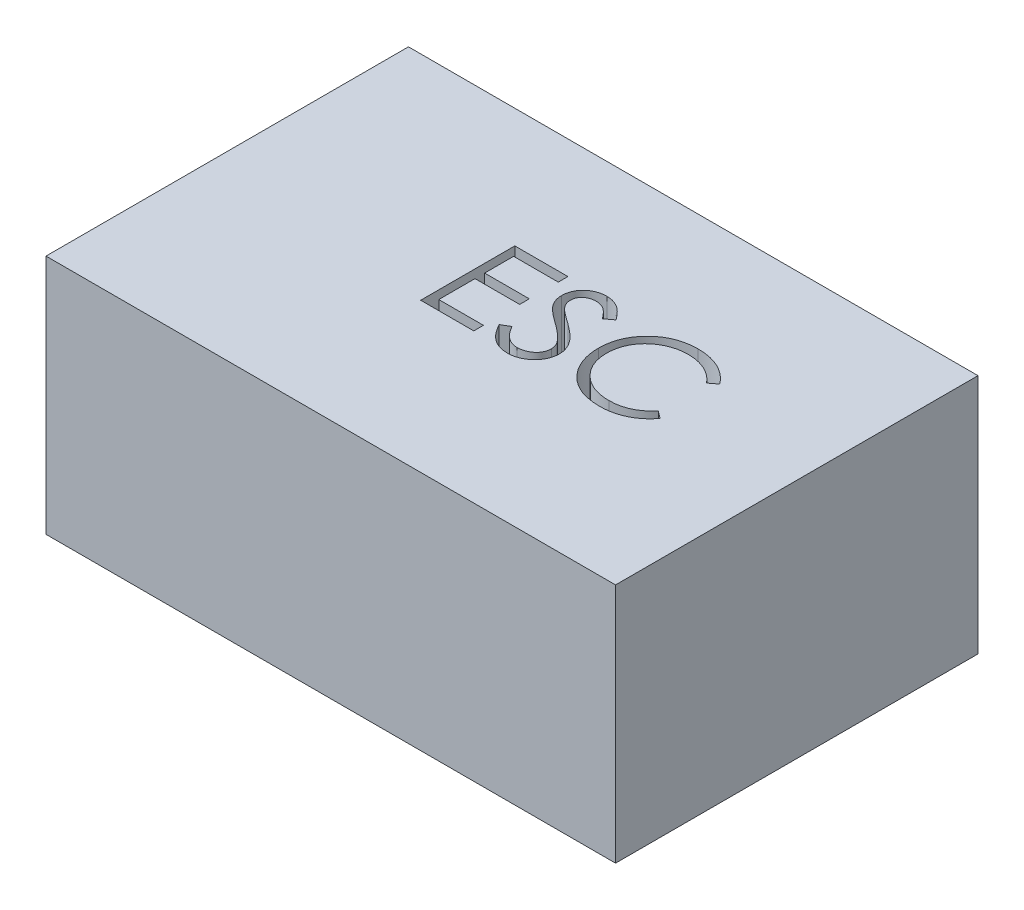
from build123d import *

# Parameters (mm, degrees)
SKETCH1_W           = 60.5
SKETCH1_H           = 38.5
BOSS_EXTRUDE1_DEPTH = 25.6
CUT_EXTRUDE1_DEPTH  = 10


with BuildPart() as part:
    # Sketch1 → Boss-Extrude1 (new body)
    with BuildSketch(Plane(origin=(0, 0, 0), x_dir=(1, 0, 0), z_dir=(0, 1, 0))):
        with Locations((30.25, 19.25)):
            Rectangle(SKETCH1_W, SKETCH1_H)
    extrude(amount=BOSS_EXTRUDE1_DEPTH)

    # Sketch2 → Cut-Extrude1 (cut)
    with BuildSketch(Plane(origin=(0, 25.6, 0), x_dir=(1, 0, 0), z_dir=(0, 1, 0))):
        Polygon((23.963191453, 25.836787702), (29.604217094, 25.836787702), (29.604217094, 24.811146676), (24.86062735, 24.811146676), (24.86062735, 21.734223599), (29.604217094, 21.734223599), (29.604217094, 20.708582573), (24.86062735, 20.708582573), (24.86062735, 16.862428727), (29.604217094, 16.862428727), (29.604217094, 15.836787702), (23.963191453, 15.836787702), align=None)
        with BuildLine():
            Line((30.373447863, 17.76587424), (31.218800427, 18.272685138))
            add(Edge.make_bspline(
                [(31.218800427, 18.272685138), (31.297423962, 18.141072609), (31.448063621, 17.888908084), (31.699353219, 17.548170825), (31.959732965, 17.258564663), (32.231131061, 17.021774356), (32.511890913, 16.835348965), (32.803845352, 16.703342589), (33.106010525, 16.621011231), (33.311650015, 16.611010983), (33.414313248, 16.606018471)],
                knots=[0, 0, 0, 0, 1.272034388, 2.437168799, 3.508375237, 4.49857839, 5.41946034, 6.295179144, 7.148887113, 8, 8, 8, 8], degree=3))
            add(Edge.make_bspline(
                [(33.414313248, 16.606018471), (33.501989992, 16.608460392), (33.675809344, 16.613301507), (33.931701467, 16.659818085), (34.180220902, 16.73128131), (34.416245581, 16.833626829), (34.636518765, 16.957451074), (34.829680752, 17.107011581), (34.996669647, 17.274457883), (35.133267117, 17.461265468), (35.238067218, 17.662171606), (35.318615985, 17.86838861), (35.363316195, 18.083155948), (35.370049776, 18.227757271), (35.373447863, 18.300730009)],
                knots=[0, 0, 0, 0, 1.095163259, 2.171163733, 3.241058638, 4.321873601, 5.38011039, 6.391990106, 7.366004449, 8.327778327, 9.272591725, 10.192022065, 11.087607919, 12, 12, 12, 12], degree=3))
            add(Edge.make_bspline(
                [(35.373447863, 18.300730009), (35.369235547, 18.38398958), (35.360672524, 18.55324412), (35.288296866, 18.802957415), (35.174441875, 19.050079043), (35.06940575, 19.202939802), (35.014874145, 19.282300522)],
                knots=[0, 0, 0, 0, 0.938893495, 1.908633276, 2.914225137, 4, 4, 4, 4], degree=3))
            add(Edge.make_bspline(
                [(35.014874145, 19.282300522), (34.970100962, 19.339577161), (34.876105264, 19.4598223), (34.714512371, 19.638808687), (34.524894901, 19.823432741), (34.313741887, 20.020744332), (34.073361634, 20.221566609), (33.811283021, 20.435475974), (33.520814853, 20.654337623), (33.317102005, 20.801116382), (33.21198953, 20.876851804)],
                knots=[0, 0, 0, 0, 0.722233717, 1.516239348, 2.393582979, 3.351407094, 4.387010283, 5.505090956, 6.712668013, 8, 8, 8, 8], degree=3))
            add(Edge.make_bspline(
                [(33.21198953, 20.876851804), (33.106778112, 20.951790626), (32.905621894, 21.095067947), (32.624311658, 21.307708758), (32.37275605, 21.502119814), (32.152073145, 21.680131277), (31.962360011, 21.841767291), (31.802121694, 21.985475688), (31.675440103, 22.115143005), (31.604995586, 22.199261124), (31.573367735, 22.237028086)],
                knots=[0, 0, 0, 0, 1.452282411, 2.77665338, 3.964542531, 5.026858415, 5.96415736, 6.766646006, 7.446254459, 8, 8, 8, 8], degree=3))
            add(Edge.make_bspline(
                [(31.573367735, 22.237028086), (31.529160463, 22.295888192), (31.44222093, 22.411644488), (31.327460914, 22.592572653), (31.229920449, 22.777781983), (31.153456643, 22.967770167), (31.089067446, 23.159869964), (31.045759073, 23.356587809), (31.018640796, 23.557041005), (31.015863691, 23.691936721), (31.014473504, 23.759463984)],
                knots=[0, 0, 0, 0, 1.068054152, 2.10047183, 3.106115577, 4.101338837, 5.06977816, 6.043150881, 7.020423561, 8, 8, 8, 8], degree=3))
            add(Edge.make_bspline(
                [(31.014473504, 23.759463984), (31.018202673, 23.86526334), (31.025581302, 24.074600665), (31.08798278, 24.380403037), (31.186476761, 24.672364229), (31.324462155, 24.947593754), (31.502340307, 25.198925128), (31.708185948, 25.429249377), (31.953361623, 25.622873897), (32.222369118, 25.792051207), (32.516815895, 25.924468136), (32.825361333, 26.024356651), (33.148495825, 26.08095453), (33.367361924, 26.089076716), (33.478415812, 26.093197958)],
                knots=[0, 0, 0, 0, 1.005424448, 1.989358655, 2.955360095, 3.929531133, 4.905563448, 5.876582895, 6.856512386, 7.866279853, 8.892233794, 9.918561126, 10.94386622, 12, 12, 12, 12], degree=3))
            add(Edge.make_bspline(
                [(33.478415812, 26.093197958), (33.596256099, 26.089133525), (33.830602818, 26.081050665), (34.175314862, 26.010772004), (34.507202624, 25.89448437), (34.77418338, 25.762516776), (34.983134127, 25.630712731), (35.142484792, 25.51065609), (35.303963223, 25.372441494), (35.468871951, 25.215700791), (35.634416692, 25.038995788), (35.803055127, 24.843536677), (35.975181609, 24.630517946), (36.085912638, 24.478447944), (36.142678633, 24.400489625)],
                knots=[0, 0, 0, 0, 1.286793592, 2.559021753, 3.825965368, 5.121522368, 5.803751409, 6.523245864, 7.299691795, 8.125521123, 9.008227632, 9.944561021, 10.946284179, 12, 12, 12, 12], degree=3))
            Line((36.142678633, 24.400489625), (35.331380556, 23.78550565))
            add(Edge.make_bspline(
                [(35.331380556, 23.78550565), (35.282392177, 23.848616194), (35.188052014, 23.970152347), (35.044824909, 24.140356105), (34.909828772, 24.295831761), (34.77682763, 24.430874984), (34.652845825, 24.552881079), (34.532511419, 24.657337527), (34.41755613, 24.7452678), (34.272650671, 24.839106543), (34.090600047, 24.932125124), (33.862072801, 25.010836776), (33.623254872, 25.058136953), (33.460598782, 25.064390917), (33.378255556, 25.067556932)],
                knots=[0, 0, 0, 0, 1.181633172, 2.275549214, 3.290209073, 4.226197932, 5.078386478, 5.862611352, 6.581680152, 7.217281963, 8.414376989, 9.595101626, 10.782541182, 12, 12, 12, 12], degree=3))
            add(Edge.make_bspline(
                [(33.378255556, 25.067556932), (33.274951206, 25.064094933), (33.075738499, 25.057418792), (32.792909253, 24.984504548), (32.538355181, 24.869699233), (32.319633567, 24.708799296), (32.137527918, 24.518167888), (32.005798036, 24.298799731), (31.926511852, 24.056564295), (31.916836767, 23.887588134), (31.911909402, 23.801531291)],
                knots=[0, 0, 0, 0, 1.14458467, 2.207223713, 3.21896685, 4.227309161, 5.202851033, 6.127160689, 7.046193047, 8, 8, 8, 8], degree=3))
            add(Edge.make_bspline(
                [(31.911909402, 23.801531291), (31.913032621, 23.747955638), (31.915280895, 23.640716726), (31.94663746, 23.482284092), (31.986921257, 23.324251693), (32.050757348, 23.167330028), (32.138886787, 23.008774716), (32.254615861, 22.845855466), (32.400368181, 22.677136299), (32.512016788, 22.567400945), (32.570963889, 22.509463984)],
                knots=[0, 0, 0, 0, 0.858281714, 1.717966888, 2.583508476, 3.4729293, 4.427298488, 5.488583878, 6.674047936, 8, 8, 8, 8], degree=3))
            add(Edge.make_bspline(
                [(32.570963889, 22.509463984), (32.592853524, 22.489929624), (32.644858288, 22.443520458), (32.739932361, 22.367542513), (32.865483213, 22.273820306), (33.018232359, 22.157856545), (33.20099625, 22.023338082), (33.413794982, 21.871984904), (33.654256504, 21.698883593), (33.82489055, 21.577862048), (33.91511453, 21.513871035)],
                knots=[0, 0, 0, 0, 0.420754252, 0.999615792, 1.744751191, 2.668019286, 3.750313428, 4.999500688, 6.413464383, 8, 8, 8, 8], degree=3))
            add(Edge.make_bspline(
                [(33.91511453, 21.513871035), (34.023645711, 21.434895722), (34.233801301, 21.281970974), (34.532822957, 21.052211888), (34.803948123, 20.827503978), (35.048128705, 20.609282244), (35.267777015, 20.399201978), (35.460456217, 20.194735748), (35.628129589, 19.997348398), (35.808641642, 19.744283896), (35.993092555, 19.433480798), (36.151496862, 19.052685831), (36.251377855, 18.670410629), (36.264439327, 18.413476811), (36.270883761, 18.286707573)],
                knots=[0, 0, 0, 0, 1.163667725, 2.253281268, 3.268753668, 4.215851969, 5.092017293, 5.902905408, 6.650798638, 7.335211899, 8.59617414, 9.77448103, 10.901945474, 12, 12, 12, 12], degree=3))
            add(Edge.make_bspline(
                [(36.270883761, 18.286707573), (36.269006223, 18.197055102), (36.265287609, 18.019491149), (36.222542141, 17.758762358), (36.159914526, 17.505531301), (36.065522429, 17.262928123), (35.950313405, 17.026514515), (35.804124126, 16.802491943), (35.634673598, 16.585902233), (35.440291413, 16.382520829), (35.227588835, 16.195817412), (35.002778278, 16.029734379), (34.765491784, 15.891253455), (34.517016594, 15.778251049), (34.257295632, 15.68986957), (33.986416249, 15.625832801), (33.703931932, 15.58653077), (33.511930556, 15.582451452), (33.414313248, 15.580377445)],
                knots=[0, 0, 0, 0, 0.983748083, 1.948392443, 2.894712957, 3.844097841, 4.80183111, 5.778335162, 6.776009319, 7.81870978, 8.863265674, 9.881300176, 10.883814829, 11.87499822, 12.874611388, 13.892143829, 14.928324115, 16, 16, 16, 16], degree=3))
            add(Edge.make_bspline(
                [(33.414313248, 15.580377445), (33.338783697, 15.581837964), (33.188675811, 15.584740608), (32.96664872, 15.610401409), (32.749107036, 15.64670742), (32.538780516, 15.704347619), (32.33295934, 15.77428184), (32.13253867, 15.860391361), (31.937421373, 15.963583365), (31.746513994, 16.08156915), (31.560302066, 16.218876992), (31.380532158, 16.378801267), (31.201305913, 16.556931281), (31.027913353, 16.75810432), (30.856847226, 16.979070271), (30.691480342, 17.221896509), (30.52838972, 17.485260377), (30.426059812, 17.670589193), (30.373447863, 17.76587424)],
                knots=[0, 0, 0, 0, 0.915332311, 1.819136955, 2.706846663, 3.586547465, 4.459518054, 5.340707479, 6.227863349, 7.133153174, 8.059268498, 9.028702269, 10.047606654, 11.120612155, 12.245963614, 13.433783089, 14.680604001, 16, 16, 16, 16], degree=3))
        make_face()
        with BuildLine():
            Line((47.552935043, 24.001851804), (46.767678633, 23.400890266))
            add(Edge.make_bspline(
                [(46.767678633, 23.400890266), (46.711661809, 23.46765018), (46.600383389, 23.600269939), (46.421357096, 23.786497209), (46.234780974, 23.960969384), (46.040726342, 24.124517612), (45.835700286, 24.271422657), (45.624669433, 24.409340094), (45.404103589, 24.532962202), (45.099098633, 24.682856448), (44.700104781, 24.839274034), (44.197833812, 24.970426123), (43.673516388, 25.053915197), (43.31580896, 25.062957601), (43.13386453, 25.067556932)],
                knots=[0, 0, 0, 0, 0.757959112, 1.505699292, 2.245454638, 2.979532153, 3.711538275, 4.438200793, 5.171680507, 5.909471876, 7.393775596, 8.890124382, 10.418191784, 12, 12, 12, 12], degree=3))
            add(Edge.make_bspline(
                [(43.13386453, 25.067556932), (43.033626532, 25.066402754), (42.834080839, 25.064105108), (42.537942343, 25.033793322), (42.247333626, 24.991189865), (41.962443722, 24.927974656), (41.683635269, 24.848052887), (41.409085549, 24.752551704), (41.14276955, 24.634395019), (40.881003155, 24.503799991), (40.630205409, 24.356293006), (40.392905272, 24.195397714), (40.169968221, 24.022914582), (39.961217901, 23.838197135), (39.766440906, 23.642077248), (39.587048589, 23.432464843), (39.423661703, 23.210030062), (39.273041631, 22.97770604), (39.138148107, 22.736169493), (39.025205594, 22.484526434), (38.92519096, 22.22708614), (38.846050266, 21.960939966), (38.78340879, 21.687960635), (38.740186895, 21.407415527), (38.710219834, 21.119890728), (38.707933614, 20.925006978), (38.706781197, 20.826771676)],
                knots=[0, 0, 0, 0, 1.054917814, 2.100044995, 3.131103042, 4.146048494, 5.169673617, 6.183595914, 7.203665975, 8.234915748, 9.262203917, 10.264457458, 11.251630812, 12.227803204, 13.197192746, 14.159520551, 15.12972552, 16.100847026, 17.073214652, 18.039054194, 19.002613845, 19.979014051, 20.95965708, 21.949030935, 22.966165397, 24, 24, 24, 24], degree=3))
            add(Edge.make_bspline(
                [(38.706781197, 20.826771676), (38.710386394, 20.678967905), (38.71746472, 20.388774805), (38.780459961, 19.963715918), (38.876188793, 19.556513993), (39.01966187, 19.169714443), (39.196573443, 18.798547706), (39.420118047, 18.449293839), (39.67902244, 18.116675083), (39.976949352, 17.808552376), (40.303823112, 17.527084589), (40.654531431, 17.279225785), (41.028200825, 17.072611835), (41.420705483, 16.900680559), (41.835065808, 16.76851848), (42.270536672, 16.675478127), (42.726170944, 16.614786183), (43.037512087, 16.608975645), (43.195963889, 16.606018471)],
                knots=[0, 0, 0, 0, 1.029171465, 2.020641659, 2.987623507, 3.938342917, 4.889210282, 5.84687017, 6.821220943, 7.821438502, 8.827599549, 9.822697543, 10.807740252, 11.797342354, 12.80366471, 13.83203677, 14.896651826, 16, 16, 16, 16], degree=3))
            add(Edge.make_bspline(
                [(43.195963889, 16.606018471), (43.370543, 16.610843556), (43.714156454, 16.620340477), (44.218065101, 16.700795475), (44.700453003, 16.831246669), (45.161346107, 17.013812161), (45.599445096, 17.251141555), (46.015435554, 17.538849776), (46.409668613, 17.879673584), (46.646729419, 18.139911093), (46.767678633, 18.272685138)],
                knots=[0, 0, 0, 0, 1.028121516, 2.023589091, 2.998037872, 3.967518031, 4.937445131, 5.927275754, 6.942489185, 8, 8, 8, 8], degree=3))
            Line((46.767678633, 18.272685138), (47.552935043, 17.677733214))
            add(Edge.make_bspline(
                [(47.552935043, 17.677733214), (47.489740443, 17.59619478), (47.363653942, 17.433508477), (47.15948818, 17.204160735), (46.944410187, 16.988434919), (46.716822444, 16.788070287), (46.47934304, 16.599057528), (46.227707861, 16.426766582), (45.965224911, 16.268792626), (45.692783543, 16.124144271), (45.410673221, 15.995809279), (45.119231978, 15.885941371), (44.819716048, 15.79129883), (44.512111738, 15.713436153), (44.195781005, 15.652661628), (43.871865364, 15.612033986), (43.539665721, 15.584199944), (43.315547375, 15.581663042), (43.201973504, 15.580377445)],
                knots=[0, 0, 0, 0, 0.986787822, 1.968848986, 2.935600012, 3.899624008, 4.868462664, 5.837806735, 6.815139263, 7.798259679, 8.787526145, 9.778297419, 10.776456485, 11.791383307, 12.812564526, 13.85620153, 14.913611965, 16, 16, 16, 16], degree=3))
            add(Edge.make_bspline(
                [(43.201973504, 15.580377445), (43.09442017, 15.581125995), (42.88174677, 15.582606161), (42.567750336, 15.606583782), (42.26206582, 15.639297316), (41.965566889, 15.688554833), (41.676635532, 15.746681519), (41.397891004, 15.824599395), (41.126590403, 15.911882728), (40.863823716, 16.014468405), (40.609367431, 16.130228926), (40.364042255, 16.261061952), (40.12796102, 16.405867279), (39.898802674, 16.561453023), (39.679952435, 16.732816743), (39.469513792, 16.917578556), (39.266306717, 17.115115729), (39.14058476, 17.257558167), (39.077374145, 17.329175522)],
                knots=[0, 0, 0, 0, 1.114604814, 2.203992996, 3.262667896, 4.300477797, 5.318619304, 6.316056647, 7.298880507, 8.271930387, 9.238335007, 10.195173496, 11.151986948, 12.108099108, 13.064862484, 14.031167946, 15.010108607, 16, 16, 16, 16], degree=3))
            add(Edge.make_bspline(
                [(39.077374145, 17.329175522), (38.97612945, 17.453578919), (38.774862373, 17.700883806), (38.51736042, 18.101700895), (38.296938834, 18.520181492), (38.118721917, 18.958524146), (37.979399822, 19.415745252), (37.882882122, 19.892075293), (37.820163252, 20.387069414), (37.812990999, 20.723745953), (37.809345299, 20.89488065)],
                knots=[0, 0, 0, 0, 0.994628077, 1.977248131, 2.950237994, 3.925870899, 4.908910175, 5.911660606, 6.938484602, 8, 8, 8, 8], degree=3))
            add(Edge.make_bspline(
                [(37.809345299, 20.89488065), (37.813788709, 21.074753375), (37.822530841, 21.428641731), (37.896804543, 21.947995883), (38.016286818, 22.445571308), (38.185992214, 22.92043915), (38.40115036, 23.375097093), (38.666940685, 23.806071964), (38.980275378, 24.216119963), (39.338696999, 24.599019253), (39.731746529, 24.949131689), (40.152657426, 25.257149414), (40.600605846, 25.513485174), (41.07065685, 25.727759924), (41.566330226, 25.89245839), (42.086568424, 26.007753209), (42.630393895, 26.079516398), (43.001429397, 26.088588421), (43.189954274, 26.093197958)],
                knots=[0, 0, 0, 0, 1.032925535, 2.032216505, 3.007276963, 3.968222605, 4.92396291, 5.891752235, 6.871517503, 7.883894988, 8.900124299, 9.891468569, 10.874487609, 11.85992873, 12.854644235, 13.869047385, 14.917252991, 16, 16, 16, 16], degree=3))
            add(Edge.make_bspline(
                [(43.189954274, 26.093197958), (43.304852765, 26.09182042), (43.532282757, 26.089093723), (43.868718907, 26.062504746), (44.196268412, 26.018180157), (44.515156933, 25.957848529), (44.826935836, 25.882970467), (45.129222238, 25.785426758), (45.423789915, 25.673893811), (45.708781081, 25.545441051), (45.982828368, 25.401250362), (46.24584642, 25.242920009), (46.495746017, 25.070646279), (46.734285584, 24.885894349), (46.957474758, 24.684755608), (47.171650411, 24.472762477), (47.369539206, 24.243808693), (47.491691192, 24.082651739), (47.552935043, 24.001851804)],
                knots=[0, 0, 0, 0, 1.096760587, 2.17092713, 3.219439832, 4.250915756, 5.268269357, 6.278326846, 7.281116186, 8.274029601, 9.260640565, 10.235837813, 11.203064059, 12.156899882, 13.114053108, 14.069676657, 15.032185724, 16, 16, 16, 16], degree=3))
        make_face()
    extrude(amount=-CUT_EXTRUDE1_DEPTH, mode=Mode.SUBTRACT)


solid = part.part
